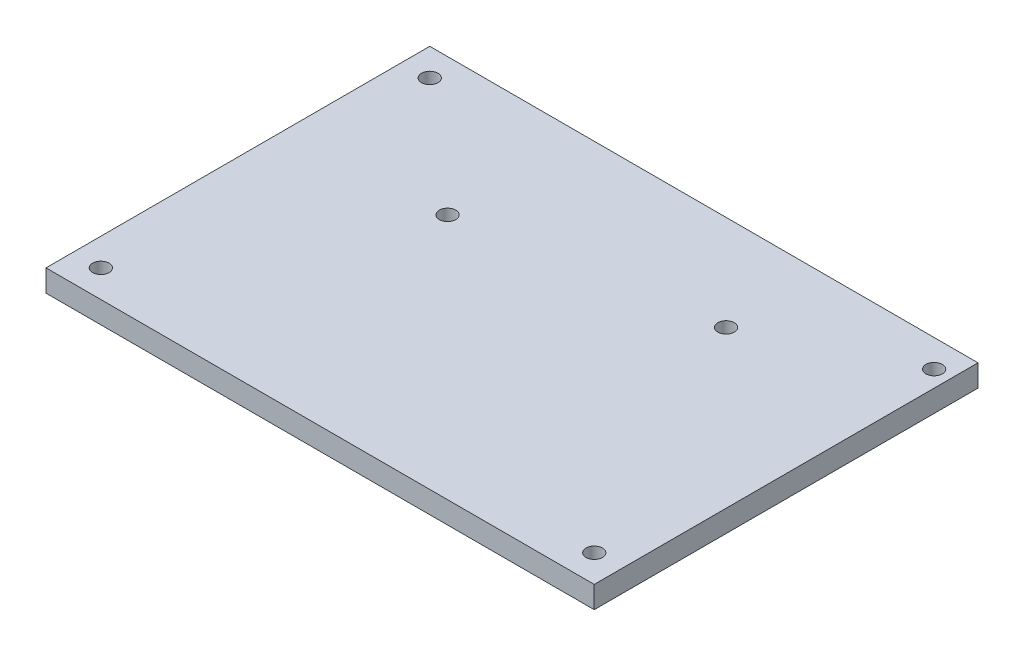
from build123d import *

# Parameters (mm, degrees)
CROQUIS1_W              = 100
CROQUIS1_H              = 70
SALIENTE_EXTRUIR1_DEPTH = 4
CROQUIS2_R              = 1.5
CORTAR_EXTRUIR1_DEPTH   = 123.131077126


with BuildPart() as part:
    # Croquis1 → Saliente-Extruir1 (new body)
    with BuildSketch(Plane(origin=(0, 0, 0), x_dir=(1, 0, 0), z_dir=(0, 1, 0))):
        with Locations((50, -35)):
            Rectangle(CROQUIS1_W, CROQUIS1_H)
    extrude(amount=SALIENTE_EXTRUIR1_DEPTH)

    # Croquis2 → Cortar-Extruir1 (cut, through all)
    with BuildSketch(Plane(origin=(0, 4, 0), x_dir=(1, 0, 0), z_dir=(0, 1, 0))):
        with Locations(Location((28.25, -25, 0), (0, 0, 270))):
            Circle(CROQUIS2_R)
        with Locations(Location((71.43, -17.38, 0), (0, 0, 270))):
            Circle(CROQUIS2_R)
        with Locations(Location((5, -65, 0), (0, 0, 270))):
            Circle(CROQUIS2_R)
        with Locations(Location((95, -65, 0), (0, 0, 270))):
            Circle(CROQUIS2_R)
        with Locations(Location((97, -5, 0), (0, 0, 270))):
            Circle(CROQUIS2_R)
        with Locations(Location((5, -5, 0), (0, 0, 270))):
            Circle(CROQUIS2_R)
    extrude(amount=-CORTAR_EXTRUIR1_DEPTH, mode=Mode.SUBTRACT)


solid = part.part
